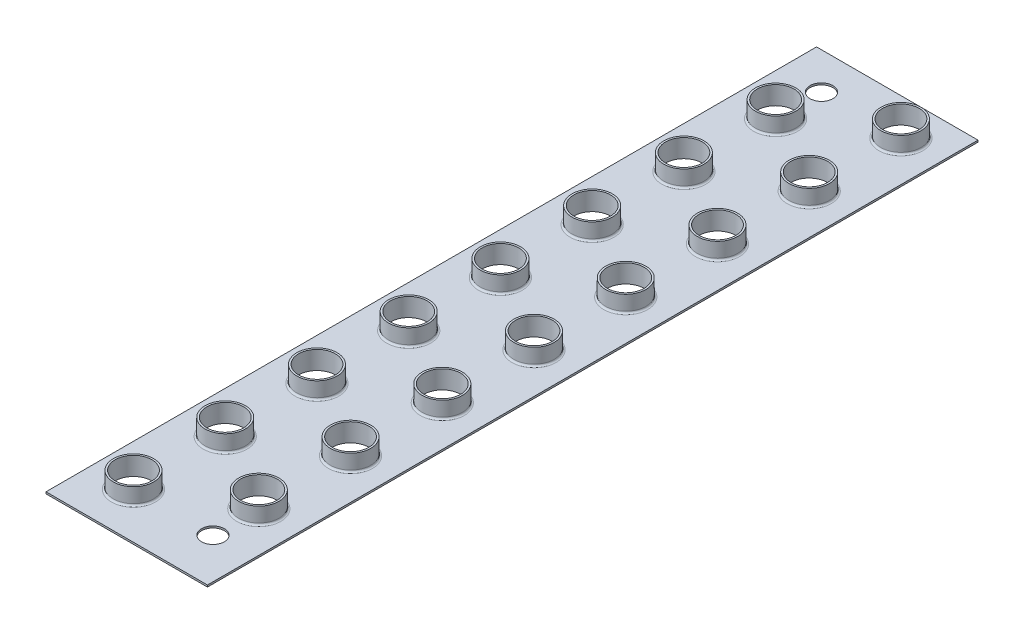
from build123d import *

# Parameters (mm, degrees)
SKETCH1_W              = 44
SKETCH1_H              = 210
BOSS_EXTRUDE1_DEPTH    = 0.5
SKETCH2_R              = 5
CUT_EXTRUDE1_DEPTH     = 0.5
BOSS_EXTRUDE3_START    = 4.5
SKETCH3_R              = 5.5
SKETCH3_R_2            = 5
BOSS_EXTRUDE3_DEPTH    = 4.5
FILLET1_R              = 0.5
LPATTERN1_COUNT        = 8
LPATTERN1_PITCH        = 25
FILLET1_OF_LPATTERN1_R = 0.5
SKETCH5_R              = 3.1
CUT_EXTRUDE2_DEPTH     = 4.5


with BuildPart() as part:
    # Sketch1 → Boss-Extrude1 (new body)
    with BuildSketch(Plane(origin=(0, 0, 0), x_dir=(1, 0, 0), z_dir=(0, 1, 0))):
        with Locations((22, 105)):
            Rectangle(SKETCH1_W, SKETCH1_H)
    extrude(amount=BOSS_EXTRUDE1_DEPTH)

    # Sketch2 → Cut-Extrude1 (cut)
    with BuildSketch(Plane(origin=(0, 0.5, 0), x_dir=(1, 0, 0), z_dir=(0, 1, 0))):
        with Locations(Location((33, 200, 0), (0, 0, 270))):
            Circle(SKETCH2_R)
        with Locations(Location((11.349364905, 187.5, 0), (0, 0, 270))):
            Circle(SKETCH2_R)
    cut_extrude1 = extrude(amount=-CUT_EXTRUDE1_DEPTH, mode=Mode.SUBTRACT)

    # Sketch3 → Boss-Extrude3 (add)
    # profile 1 of 2: a face of its own
    with BuildSketch(Plane(origin=(0, 0.5, 0), x_dir=(1, 0, 0), z_dir=(0, 1, 0)).offset(BOSS_EXTRUDE3_START)):
        with Locations(Location((33, 200, 0), (0, 0, 90))):
            Circle(SKETCH3_R)
        with Locations(Location((33, 200, 0), (0, 0, 270))):
            Circle(SKETCH3_R_2, mode=Mode.SUBTRACT)
    # profile 2 of 2: a face of its own
    with BuildSketch(Plane(origin=(0, 0.5, 0), x_dir=(1, 0, 0), z_dir=(0, 1, 0)).offset(BOSS_EXTRUDE3_START)):
        with Locations(Location((11.349364905, 187.5, 0), (0, 0, 90))):
            Circle(SKETCH3_R)
        with Locations(Location((11.349364905, 187.5, 0), (0, 0, 270))):
            Circle(SKETCH3_R_2, mode=Mode.SUBTRACT)
    boss_extrude3 = extrude(amount=-BOSS_EXTRUDE3_DEPTH)

    # Fillet1
    fillet1_edges = [part.edges().sort_by_distance(p)[0] for p in [
        (11.349364905, 0.5, -182),
        (33, 0.5, -194.5),
    ]]
    fillet(fillet1_edges, radius=FILLET1_R)

    # LPattern1: Cut-Extrude1, Boss-Extrude3 ×8
    with Locations(*[(0, 0, i * LPATTERN1_PITCH) for i in range(1, LPATTERN1_COUNT)]):
        add(cut_extrude1, mode=Mode.SUBTRACT)
        add(boss_extrude3)

    # Fillet1 of LPattern1
    fillet1_of_lpattern1_edges = [part.edges().sort_by_distance(p)[0] for p in [
        (11.349364905, 0.5, -157),
        (33, 0.5, -169.5),
        (11.349364905, 0.5, -132),
        (33, 0.5, -144.5),
        (11.349364905, 0.5, -107),
        (33, 0.5, -119.5),
        (11.349364905, 0.5, -82),
        (33, 0.5, -94.5),
        (11.349364905, 0.5, -57),
        (33, 0.5, -69.5),
        (11.349364905, 0.5, -32),
        (33, 0.5, -44.5),
        (11.349364905, 0.5, -7),
        (33, 0.5, -19.5),
    ]]
    fillet(fillet1_of_lpattern1_edges, radius=FILLET1_OF_LPATTERN1_R)

    # Sketch5 → Cut-Extrude2 (cut)
    with BuildSketch(Plane(origin=(0, 0.5, 0), x_dir=(1, 0, 0), z_dir=(0, 1, 0))):
        with Locations(Location((33, 12.5, 0), (0, 0, 270))):
            Circle(SKETCH5_R)
        with Locations(Location((11.349364905, 200, 0), (0, 0, 270))):
            Circle(SKETCH5_R)
    extrude(amount=-CUT_EXTRUDE2_DEPTH, mode=Mode.SUBTRACT)


solid = part.part
